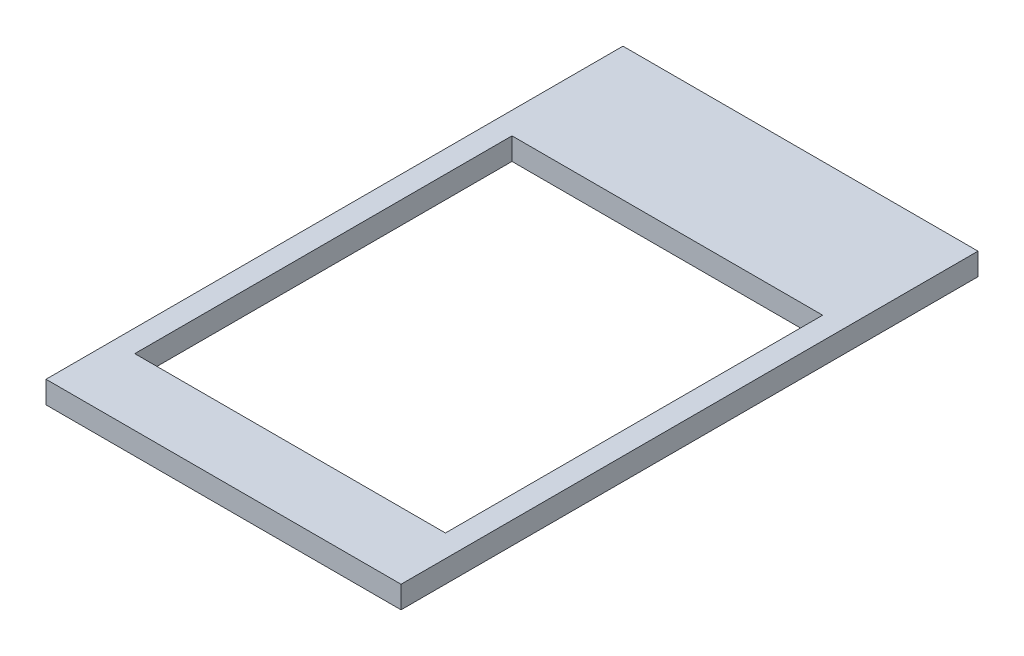
from build123d import *

# Parameters (mm, degrees)
SKETCH_1_W          = 16
SKETCH_1_H          = 26
EXTRUDE_1_DEPTH     = 5
CUT_EXTRUDE_START   = 1
SKETCH_2_W          = 14
SKETCH_2_H          = 25
CUT_EXTRUDE_1_DEPTH = 10
EXTRUDE_START       = 5
SKETCH_3_W          = 16
SKETCH_3_H          = 26
EXTRUDE_3_DEPTH     = 1
CUT_EXTRUDE_START_2 = 6
SKETCH_4_W          = 14
SKETCH_4_H          = 17
CUT_EXTRUDE_2_DEPTH = 1
SKETCH_6_W          = 16
SKETCH_6_H          = 26
CUT_EXTRUDE_4_DEPTH = 5


with BuildPart() as part:
    # 스케치1 → 보스-돌출1 (new body)
    with BuildSketch(Plane(origin=(0, 0, 0), x_dir=(1, 0, 0), z_dir=(0, 1, 0))):
        Rectangle(SKETCH_1_W, SKETCH_1_H)
    extrude(amount=EXTRUDE_1_DEPTH)

    # 스케치2 → 컷-돌출1 (cut)
    with BuildSketch(Plane(origin=(0, 0, 0), x_dir=(1, 0, 0), z_dir=(0, 1, 0)).offset(CUT_EXTRUDE_START)):
        with Locations((0, 0.5)):
            Rectangle(SKETCH_2_W, SKETCH_2_H)
    extrude(amount=CUT_EXTRUDE_1_DEPTH, mode=Mode.SUBTRACT)

    # 스케치6 → 컷-돌출4 (cut)
    with BuildSketch(Plane.XZ):
        Rectangle(SKETCH_6_W, SKETCH_6_H)
    extrude(amount=-CUT_EXTRUDE_4_DEPTH, mode=Mode.SUBTRACT)


with BuildPart() as body_2:
    # 스케치3 → 보스-돌출3 (new body)
    with BuildSketch(Plane(origin=(0, 0, 0), x_dir=(1, 0, 0), z_dir=(0, 1, 0)).offset(EXTRUDE_START)):
        Rectangle(SKETCH_3_W, SKETCH_3_H)
    extrude(amount=EXTRUDE_3_DEPTH)

    # 스케치4 → 컷-돌출2 (cut)
    with BuildSketch(Plane(origin=(0, 0, 0), x_dir=(1, 0, 0), z_dir=(0, 1, 0)).offset(CUT_EXTRUDE_START_2)):
        with Locations((0, -1.5)):
            Rectangle(SKETCH_4_W, SKETCH_4_H)
    extrude(amount=-CUT_EXTRUDE_2_DEPTH, mode=Mode.SUBTRACT)


solid = body_2.part
